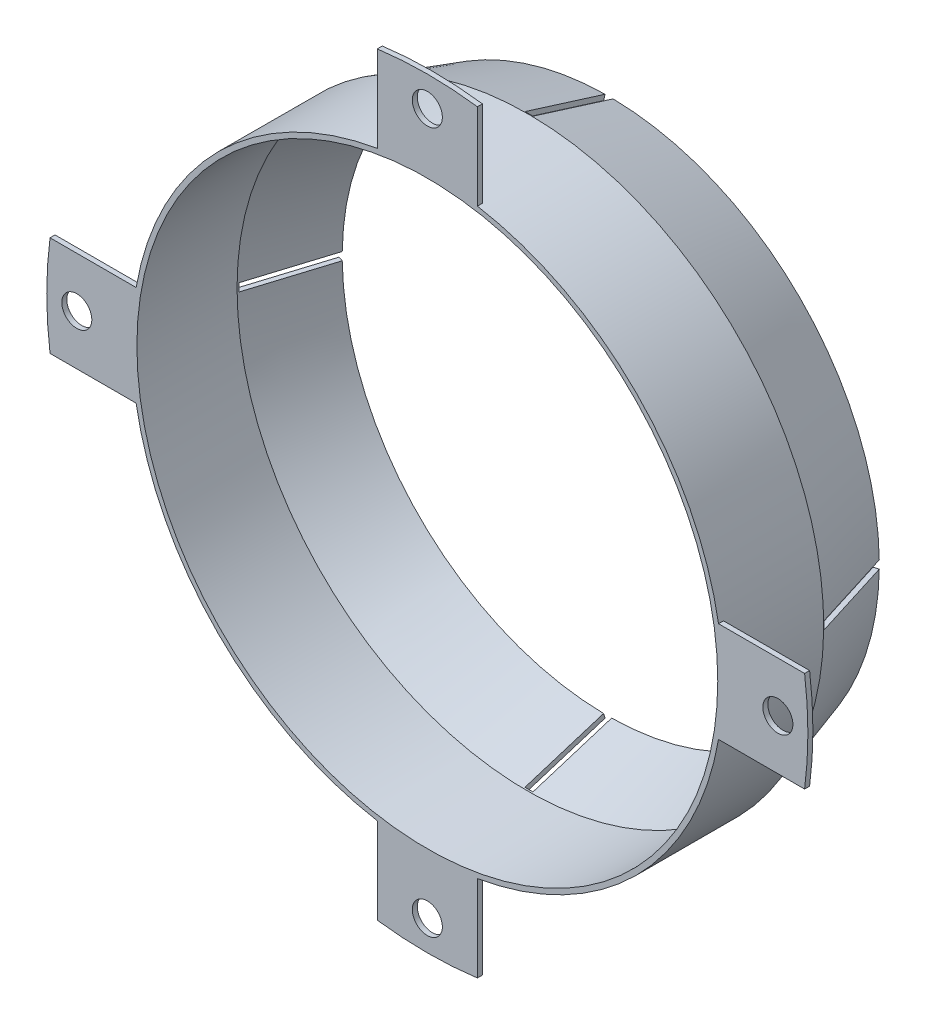
from build123d import *

# Parameters (mm, degrees)
CUT_EXTRUDE1_START = -10
CUT_EXTRUDE1_DEPTH = 10
SKETCH5_W          = 0.8
SKETCH5_H          = 8.001
CUT_EXTRUDE2_DEPTH = 57.722052077
CIRPATTERN1_COUNT  = 4


with BuildPart() as part:
    # Sketch1 → Revolve-Thin1 (revolve)
    with BuildSketch(Plane(origin=(0, 0, 0), x_dir=(0, 0, -1), z_dir=(1, 0, 0))):
        Polygon((0, 38), (0, 29), (10, 29), (18, 26.5), (18.149137497, 26.977239989), (10.076305461, 29.5), (0.5, 29.5), (0.5, 38), align=None)
    revolve(axis=Axis((0, 0, 0), (0, 0, 1)))

    # Sketch2 → Cut-Extrude1 (cut)
    with BuildSketch(Plane(origin=(0, 0, -0.5), x_dir=(-1, 0, 0), z_dir=(0, 0, -1)).offset(CUT_EXTRUDE1_START)):
        with BuildLine():
            Line((-5, 37.669616404), (-5, 29.07318352))
            ThreePointArc((-5, 29.07318352), (-20.859650045, 20.859650045), (-29.07318352, 5))
            Line((-29.07318352, 5), (-37.669616404, 5))
            ThreePointArc((-37.669616404, 5), (-26.870057685, 26.870057685), (-5, 37.669616404))
        make_face()
    cut_extrude1 = extrude(amount=CUT_EXTRUDE1_DEPTH, mode=Mode.SUBTRACT)

    # Sketch3 → Ø3.0 (3) Diameter Hole1 (revolve, cut)
    with BuildSketch(Plane(origin=(0, 35, -0.5), x_dir=(0, 1, 0), z_dir=(1, 0, 0))):
        Polygon((0, 0), (0, 23.901290929), (1.5, 23), (1.5, 0), align=None)
    f_3_0_3_diameter_hole1 = revolve(axis=Axis((0, 35, -6.85), (0, 0, 1)), mode=Mode.SUBTRACT)

    # Sketch5 → Cut-Extrude2 (cut, through all)
    with BuildSketch(Plane(origin=(0, 0, 0), x_dir=(1, 0, 0), z_dir=(0, 1, 0))):
        with Locations((0, 14.148637497)):
            Rectangle(SKETCH5_W, SKETCH5_H)
    cut_extrude2 = extrude(amount=-CUT_EXTRUDE2_DEPTH, mode=Mode.SUBTRACT)

    # CirPattern1: Cut-Extrude1, Ø3.0 (3) Diameter Hole1, Cut-Extrude2 ×4 about axis
    cirpattern1_axis = Axis((0, 0, -19.056594371), (0, 0, 1))
    add([cut_extrude1.rotate(cirpattern1_axis, i * 360 / CIRPATTERN1_COUNT) for i in range(1, CIRPATTERN1_COUNT)], mode=Mode.SUBTRACT)
    add([f_3_0_3_diameter_hole1.rotate(cirpattern1_axis, i * 360 / CIRPATTERN1_COUNT) for i in range(1, CIRPATTERN1_COUNT)], mode=Mode.SUBTRACT)
    add([cut_extrude2.rotate(cirpattern1_axis, i * 360 / CIRPATTERN1_COUNT) for i in range(1, CIRPATTERN1_COUNT)], mode=Mode.SUBTRACT)


solid = part.part
